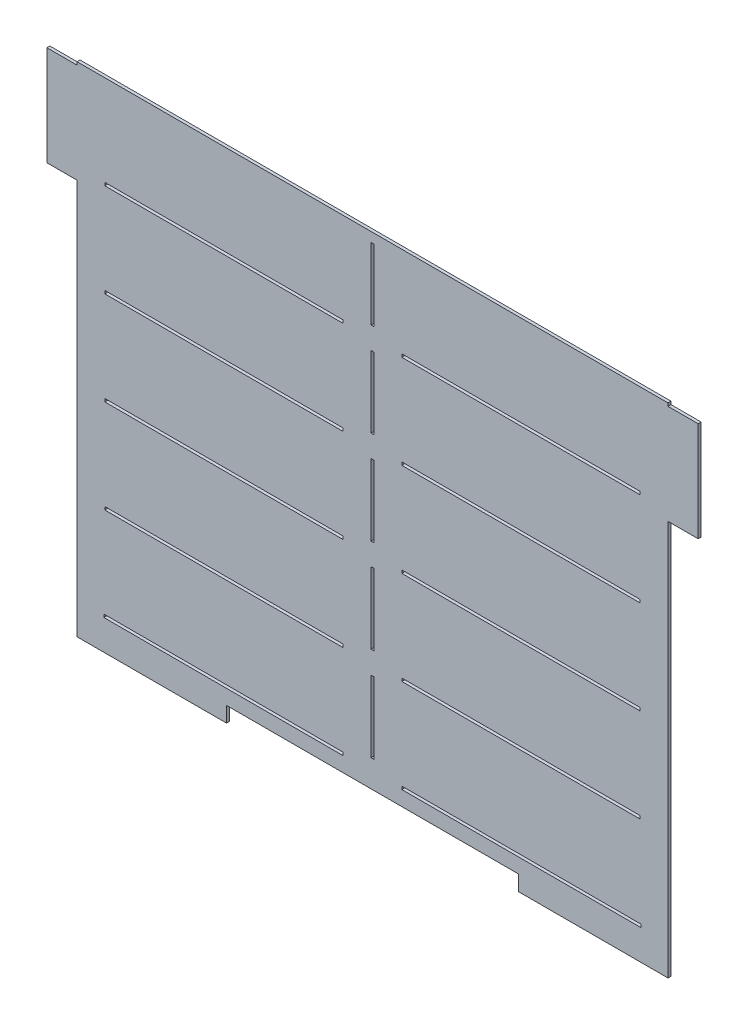
from build123d import *

# Parameters (mm, degrees)
SKETCH2_W           = 629.90984
SKETCH2_H           = 495.5921
SKETCH2_W_2         = 254
SKETCH2_H_2         = 3.175
SKETCH2_W_3         = 3.175
SKETCH2_H_3         = 76.2
BOSS_EXTRUDE1_DEPTH = 3.175
SKETCH4_W           = 28.585012188
SKETCH4_H           = 3.175
SKETCH4_W_2         = 62.54242
BOSS_EXTRUDE2_DEPTH = 3.175
SKETCH5_W           = 32.131
SKETCH5_H           = 106.20248
BOSS_EXTRUDE3_DEPTH = 3.175


with BuildPart() as part:
    # Sketch2 → Boss-Extrude1 (new body)
    with BuildSketch(Plane.XY):
        with Locations((313.68492, 246.52605)):
            Rectangle(SKETCH2_W, SKETCH2_H)
        with Locations((155.41371, 96.89592)):
            Rectangle(SKETCH2_W_2, SKETCH2_H_2, mode=Mode.SUBTRACT)
        with Locations((155.41371, 196.64934)):
            Rectangle(SKETCH2_W_2, SKETCH2_H_2, mode=Mode.SUBTRACT)
        with Locations((155.41371, 296.40276)):
            Rectangle(SKETCH2_W_2, SKETCH2_H_2, mode=Mode.SUBTRACT)
        with Locations((155.41371, 396.15618)):
            Rectangle(SKETCH2_W_2, SKETCH2_H_2, mode=Mode.SUBTRACT)
        with Locations((471.95613, 96.89592)):
            Rectangle(SKETCH2_W_2, SKETCH2_H_2, mode=Mode.SUBTRACT)
        with Locations((471.95613, 196.64934)):
            Rectangle(SKETCH2_W_2, SKETCH2_H_2, mode=Mode.SUBTRACT)
        with Locations((471.95613, 396.15618)):
            Rectangle(SKETCH2_W_2, SKETCH2_H_2, mode=Mode.SUBTRACT)
        with Locations((471.95613, 296.40276)):
            Rectangle(SKETCH2_W_2, SKETCH2_H_2, mode=Mode.SUBTRACT)
        with Locations((313.68492, 46.625498166)):
            Rectangle(SKETCH2_W_3, SKETCH2_H_3, mode=Mode.SUBTRACT)
        with Locations((313.68492, 146.77263)):
            Rectangle(SKETCH2_W_3, SKETCH2_H_3, mode=Mode.SUBTRACT)
        with Locations((313.68492, 246.52605)):
            Rectangle(SKETCH2_W_3, SKETCH2_H_3, mode=Mode.SUBTRACT)
        with Locations((313.68492, 346.27947)):
            Rectangle(SKETCH2_W_3, SKETCH2_H_3, mode=Mode.SUBTRACT)
        with Locations((313.68492, 446.03289)):
            Rectangle(SKETCH2_W_3, SKETCH2_H_3, mode=Mode.SUBTRACT)
    extrude(amount=BOSS_EXTRUDE1_DEPTH)

    # Sketch4 → Boss-Extrude2 (add, through all)
    with BuildSketch(Plane.XY.offset(3.175)):
        with Locations((13.022506094, -2.8575)):
            Rectangle(SKETCH4_W, SKETCH4_H)
        with Locations((614.347333906, -2.8575)):
            Rectangle(SKETCH4_W, SKETCH4_H)
        with Locations((313.68492, -2.8575)):
            Rectangle(SKETCH4_W_2, SKETCH4_H)
    extrude(amount=-BOSS_EXTRUDE2_DEPTH)

    # Sketch5 → Boss-Extrude3 (add, through all)
    with BuildSketch(Plane.XY.offset(3.175)):
        Polygon((158.03372, -20.246485543), (158.03372, -36.576), (-1.27, -36.576), (-1.27, -7.62), (-1.27, -4.445), (628.63984, -4.445), (628.63984, -7.62), (628.63984, -36.576), (469.33612, -36.576), (469.33612, -20.246485543), align=None)
        with Locations((644.70534, 438.04586)):
            Rectangle(SKETCH5_W, SKETCH5_H)
        with Locations((-17.3355, 438.04586)):
            Rectangle(SKETCH5_W, SKETCH5_H)
    extrude(amount=-BOSS_EXTRUDE3_DEPTH)


solid = part.part
